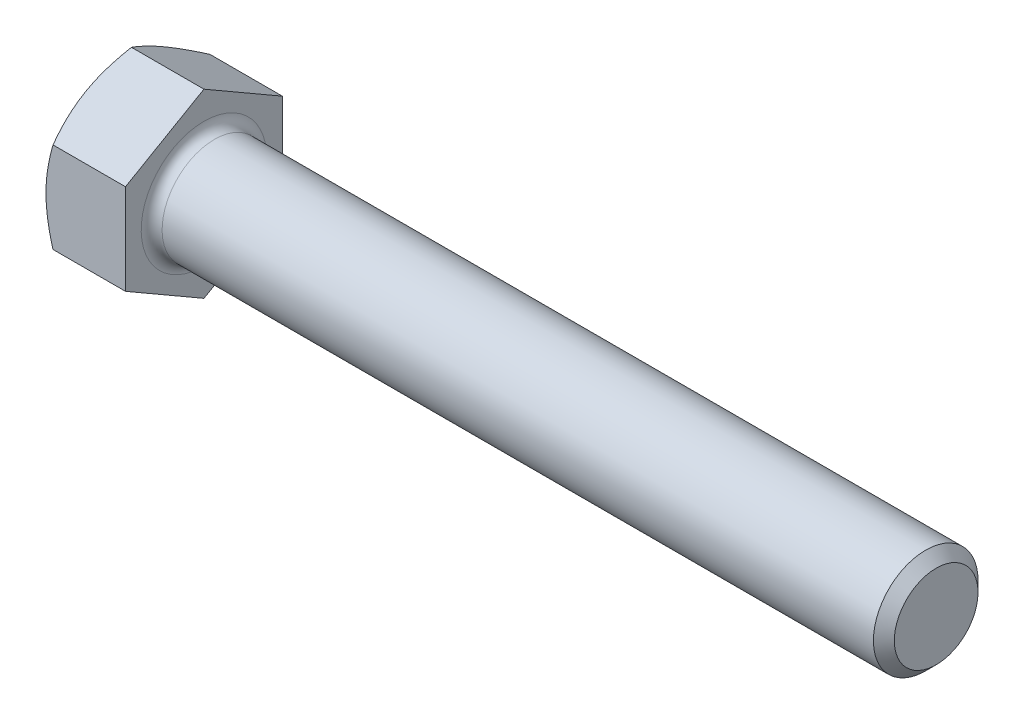
from build123d import *

# Parameters (mm, degrees)
SKETCH1_W      = 44.45
SKETCH1_H      = 3.175
HEAD_DEPTH     = 4.826
CHAMFER2_SIZE  = 0.635
CHAMFER2_SIZE2 = 0.6351
FILLET_2_R     = 0.635


with BuildPart() as part:
    # Sketch1 → Body (revolve)
    with BuildSketch(Plane.XY):
        with Locations((22.225, 1.5875)):
            Rectangle(SKETCH1_W, SKETCH1_H)
    revolve(axis=Axis((44.45, 0, 0), (-1, 0, 0)))

    # Sketch2 → Head (add)
    with BuildSketch(Plane.ZY):
        Polygon((0, 5.499261314), (4.7625, 2.749630657), (4.7625, -2.749630657), (0, -5.499261314), (-4.7625, -2.749630657), (-4.7625, 2.749630657), align=None)
    extrude(amount=HEAD_DEPTH)

    # Sketch3 → Thread (revolve, cut)
    with BuildSketch(Plane.XY):
        Polygon((-4.826, 4.7625), (-4.276073869, 5.715), (-4.826, 5.715), align=None)
    revolve(axis=Axis((-1.1, 0, 0), (1, 0, 0)), mode=Mode.SUBTRACT)

    # Chamfer2
    chamfer2_edges = [part.edges().sort_by_distance(p)[0] for p in [
        (44.45, -3.175, 0),
    ]]
    chamfer2_side = [part.faces().sort_by_distance(p)[0] for p in [
        (22.225, -3.175, 0),
    ]]
    chamfer(chamfer2_edges, length=CHAMFER2_SIZE, length2=CHAMFER2_SIZE2, reference=chamfer2_side[0])

    # Fillet 2
    fillet_2_edges = [part.edges().sort_by_distance(p)[0] for p in [
        (0, -3.175, 0),
    ]]
    fillet(fillet_2_edges, radius=FILLET_2_R)


solid = part.part
